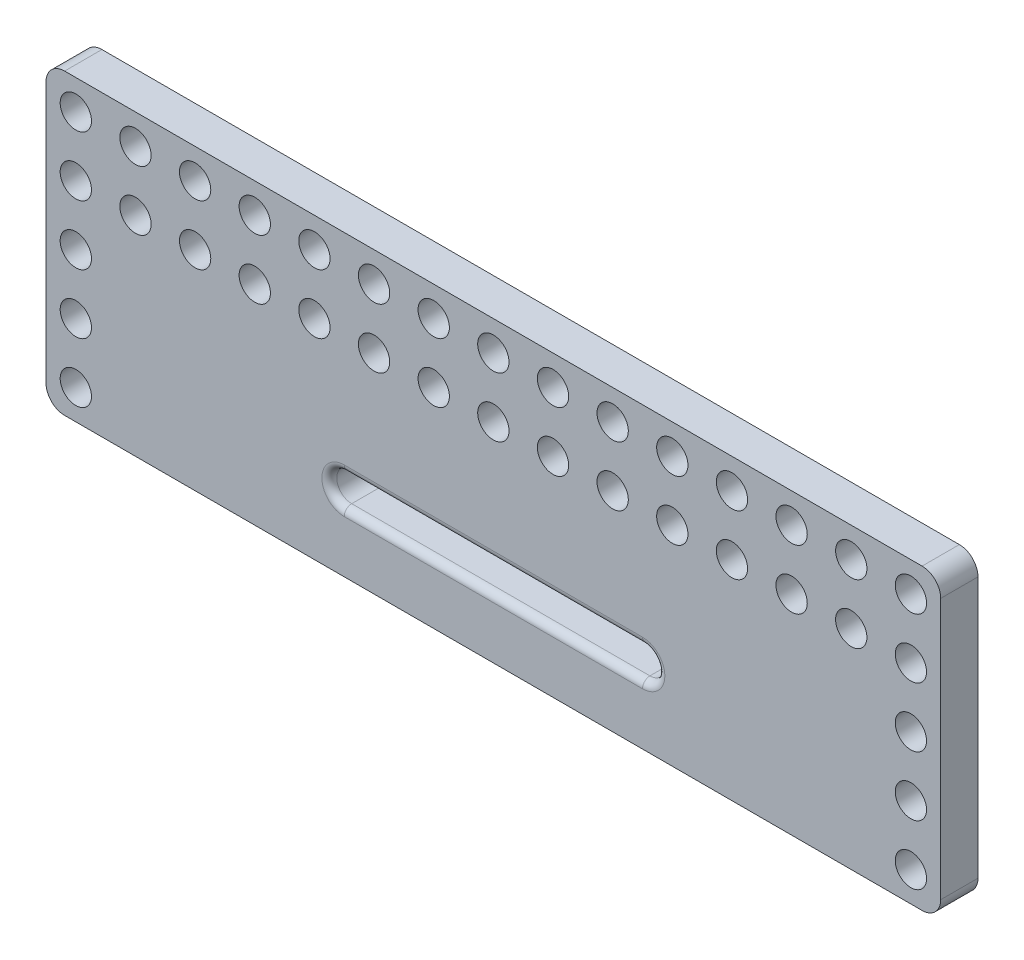
from build123d import *

# Parameters (mm, degrees)
SKETCH_1_W      = 120
SKETCH_1_H      = 40
SKETCH_1_R      = 2.1
EXTRUDE_1_DEPTH = 5
FILLET_1_R      = 2.5
FILLET_2_R      = 1


with BuildPart() as part:
    # 草图1 → 凸台-拉伸1 (new body)
    with BuildSketch(Plane.XY):
        Rectangle(SKETCH_1_W, SKETCH_1_H)
        with Locations((-56, -16)):
            Circle(SKETCH_1_R, mode=Mode.SUBTRACT)
        with Locations((-56, -8)):
            Circle(SKETCH_1_R, mode=Mode.SUBTRACT)
        with Locations((-56, 0)):
            Circle(SKETCH_1_R, mode=Mode.SUBTRACT)
        with Locations((-56, 8)):
            Circle(SKETCH_1_R, mode=Mode.SUBTRACT)
        with Locations((-56, 16)):
            Circle(SKETCH_1_R, mode=Mode.SUBTRACT)
        with Locations((56, 16)):
            Circle(SKETCH_1_R, mode=Mode.SUBTRACT)
        with Locations((56, 8)):
            Circle(SKETCH_1_R, mode=Mode.SUBTRACT)
        with Locations((56, 0)):
            Circle(SKETCH_1_R, mode=Mode.SUBTRACT)
        with Locations((56, -16)):
            Circle(SKETCH_1_R, mode=Mode.SUBTRACT)
        with Locations((56, -8)):
            Circle(SKETCH_1_R, mode=Mode.SUBTRACT)
        with Locations((-48, 16)):
            Circle(SKETCH_1_R, mode=Mode.SUBTRACT)
        with Locations((-48, 8)):
            Circle(SKETCH_1_R, mode=Mode.SUBTRACT)
        with Locations((-40, 16)):
            Circle(SKETCH_1_R, mode=Mode.SUBTRACT)
        with Locations((-40, 8)):
            Circle(SKETCH_1_R, mode=Mode.SUBTRACT)
        with Locations((-32, 16)):
            Circle(SKETCH_1_R, mode=Mode.SUBTRACT)
        with Locations((-32, 8)):
            Circle(SKETCH_1_R, mode=Mode.SUBTRACT)
        with Locations((-24, 16)):
            Circle(SKETCH_1_R, mode=Mode.SUBTRACT)
        with Locations((-24, 8)):
            Circle(SKETCH_1_R, mode=Mode.SUBTRACT)
        with Locations((-16, 16)):
            Circle(SKETCH_1_R, mode=Mode.SUBTRACT)
        with Locations((-16, 8)):
            Circle(SKETCH_1_R, mode=Mode.SUBTRACT)
        with Locations((-8, 16)):
            Circle(SKETCH_1_R, mode=Mode.SUBTRACT)
        with Locations((-8, 8)):
            Circle(SKETCH_1_R, mode=Mode.SUBTRACT)
        with Locations((0, 16)):
            Circle(SKETCH_1_R, mode=Mode.SUBTRACT)
        with Locations((0, 8)):
            Circle(SKETCH_1_R, mode=Mode.SUBTRACT)
        with Locations((8, 16)):
            Circle(SKETCH_1_R, mode=Mode.SUBTRACT)
        with Locations((8, 8)):
            Circle(SKETCH_1_R, mode=Mode.SUBTRACT)
        with Locations((16, 16)):
            Circle(SKETCH_1_R, mode=Mode.SUBTRACT)
        with Locations((16, 8)):
            Circle(SKETCH_1_R, mode=Mode.SUBTRACT)
        with Locations((24, 16)):
            Circle(SKETCH_1_R, mode=Mode.SUBTRACT)
        with Locations((24, 8)):
            Circle(SKETCH_1_R, mode=Mode.SUBTRACT)
        with Locations((32, 16)):
            Circle(SKETCH_1_R, mode=Mode.SUBTRACT)
        with Locations((32, 8)):
            Circle(SKETCH_1_R, mode=Mode.SUBTRACT)
        with Locations((40, 16)):
            Circle(SKETCH_1_R, mode=Mode.SUBTRACT)
        with Locations((40, 8)):
            Circle(SKETCH_1_R, mode=Mode.SUBTRACT)
        with Locations((48, 16)):
            Circle(SKETCH_1_R, mode=Mode.SUBTRACT)
        with Locations((48, 8)):
            Circle(SKETCH_1_R, mode=Mode.SUBTRACT)
        with BuildLine():
            Line((20, -8), (-20, -8))
            ThreePointArc((-20, -8), (-22, -10), (-20, -12))
            Line((-20, -12), (20, -12))
            ThreePointArc((20, -12), (22, -10), (20, -8))
        make_face(mode=Mode.SUBTRACT)
    extrude(amount=EXTRUDE_1_DEPTH)

    # 圆角1
    fillet_1_edges = [part.edges().sort_by_distance(p)[0] for p in [
        (60, -20, 2.5),
        (-60, -20, 2.5),
        (-60, 20, 2.5),
        (60, 20, 2.5),
    ]]
    fillet(fillet_1_edges, radius=FILLET_1_R)

    # 圆角2
    fillet_2_edges = [part.edges().sort_by_distance(p)[0] for p in [
        (0, -8, 5),
        (22, -10, 5),
        (0, -12, 5),
        (-22, -10, 5),
    ]]
    fillet(fillet_2_edges, radius=FILLET_2_R)


solid = part.part
